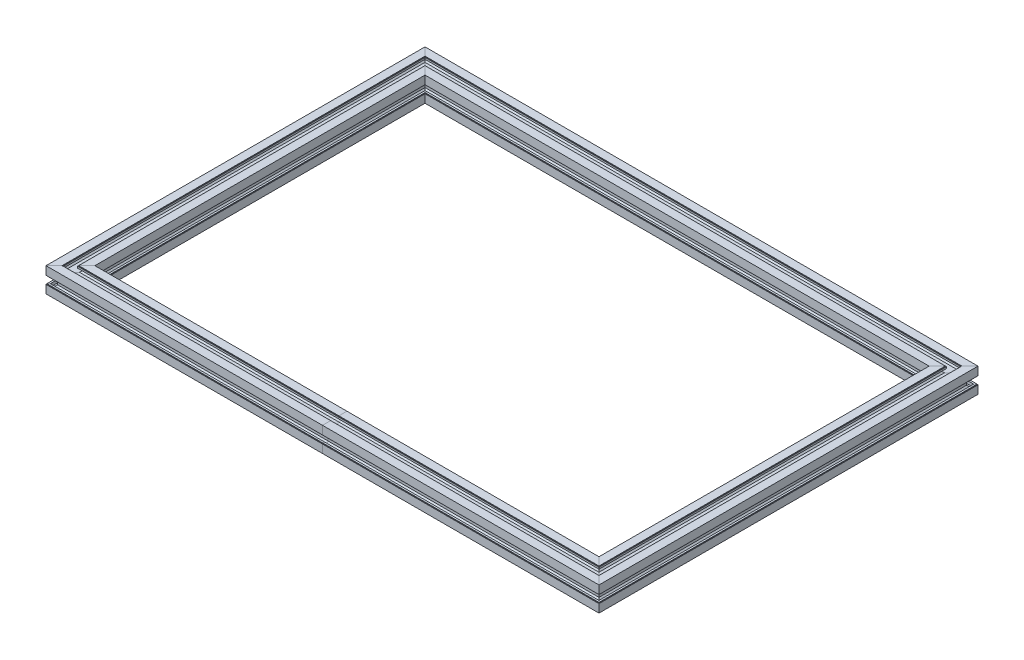
from build123d import *

# Parameters (mm, degrees)
CROQUIS2_R = 2.5


with BuildPart() as part:
    # Barrer1: sweep along a path in Croquis1
    with BuildLine(Plane(origin=(0, 0, 0), x_dir=(1, 0, 0), z_dir=(0, 1, 0))) as barrer1_path:
        Line((-210.93, 141.5), (210.93, 141.5))
        Line((210.93, 141.5), (210.93, -141.5))
        Line((210.93, -141.5), (-210.93, -141.5))
        Line((-210.93, -141.5), (-210.93, 141.5))
    # Croquis2 → Barrer1 (sweep)
    with BuildSketch(Plane(origin=(0, 0, 0), x_dir=(0, 0, -1), z_dir=(1, 0, 0))):
        Polygon((-144.848190044, 9.751218458), (-144.848190044, 9.391218458), (-144.343190044, 9.391218458), (-144.343190044, 8.021218458), (-146.678190044, 8.021218458), (-146.678190044, 6.721218458), (-145.121709911, 5.163799744), (-137.875239336, 5.163799744), (-136.318759202, 6.721218458), (-136.318759202, 8.021218458), (-138.653759202, 8.021218458), (-138.653759202, 9.391218458), (-138.148759202, 9.391218458), (-138.148759202, 9.751218458), (-131.747639801, 9.751218458), (-131.747639801, 3.185976388), (-132.107639736, 3.185759368), (-132.107335305, 2.68075946), (-133.477335056, 2.679933578), (-133.478742672, 5.014933154), (-134.778742435, 5.01414947), (-136.335222569, 3.456730756), (-136.335222569, -3.455477102), (-134.778742435, -5.012895817), (-133.478742672, -5.0136795), (-133.477335056, -2.678679924), (-132.107335305, -2.679505806), (-132.107639736, -3.184505714), (-131.747639801, -3.184722734), (-131.747639801, -9.749964804), (-138.148759202, -9.749964804), (-138.148759202, -9.389964804), (-138.653759202, -9.389964804), (-138.653759202, -8.019964804), (-136.318759202, -8.019964804), (-136.318759202, -6.719964804), (-137.875239336, -5.16254609), (-145.121709911, -5.16254609), (-146.678190044, -6.719964804), (-146.678190044, -8.019964804), (-144.343190044, -8.019964804), (-144.343190044, -9.389964804), (-144.848190044, -9.389964804), (-144.848190044, -9.749964804), (-151.249309446, -9.749964804), (-151.249309446, -3.184722734), (-150.889309511, -3.184505714), (-150.889613942, -2.679505806), (-149.519614191, -2.678679924), (-149.518206575, -5.0136795), (-148.218206811, -5.012895817), (-146.661726678, -3.455477102), (-146.661726678, 3.456730756), (-148.218206811, 5.01414947), (-149.518206575, 5.014933154), (-149.519614191, 2.679933578), (-150.889613942, 2.68075946), (-150.889309511, 3.185759368), (-151.249309446, 3.185976388), (-151.249309446, 9.751218458), align=None)
        with Locations((-141.498474623, 0.000626827)):
            Circle(CROQUIS2_R, mode=Mode.SUBTRACT)
    sweep(path=barrer1_path.line, transition=Transition.RIGHT)


solid = part.part
